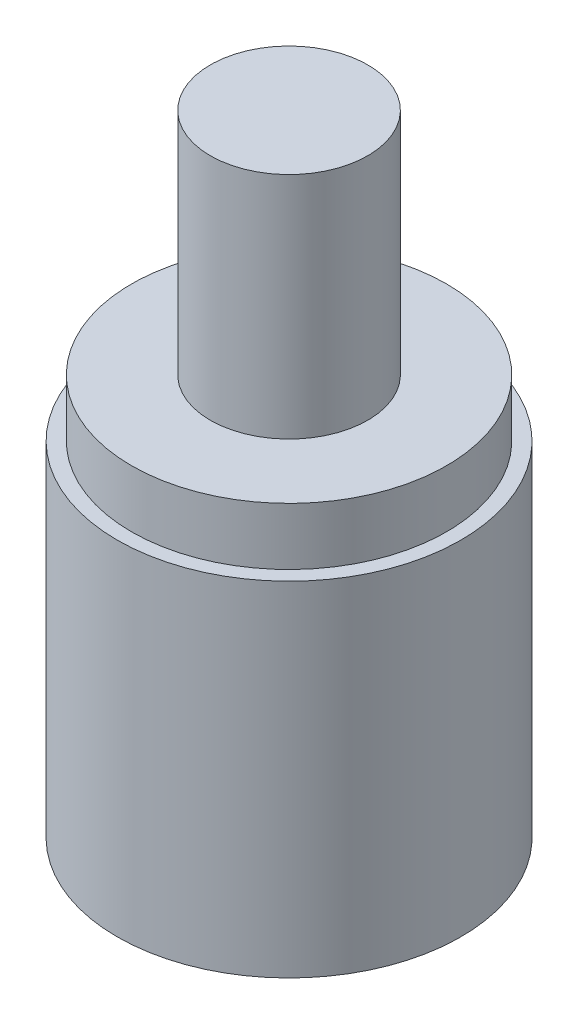
from build123d import *

# Parameters (mm, degrees)
SKETCH_1_R      = 6
SKETCH_1_R_2    = 4.75
EXTRUDE_1_DEPTH = 12
SKETCH_2_R      = 5.5
EXTRUDE_2_DEPTH = 2
SKETCH_3_R      = 2.75
EXTRUDE_3_DEPTH = 8


with BuildPart() as part:
    # 草图1 → 凸台-拉伸1 (new body)
    with BuildSketch(Plane(origin=(0, 0, 0), x_dir=(1, 0, 0), z_dir=(0, 1, 0))):
        with Locations(Location((0, 0, 0), (0, 0, 270))):
            Circle(SKETCH_1_R)
        with Locations(Location((0, 0, 0), (0, 0, 270))):
            Circle(SKETCH_1_R_2, mode=Mode.SUBTRACT)
    extrude(amount=EXTRUDE_1_DEPTH)

    # 草图2 → 凸台-拉伸2 (add)
    with BuildSketch(Plane(origin=(0, 12, 0), x_dir=(1, 0, 0), z_dir=(0, 1, 0))):
        with Locations(Location((0, 0, 0), (0, 0, 270))):
            Circle(SKETCH_2_R)
    extrude(amount=EXTRUDE_2_DEPTH)

    # 草图3 → 凸台-拉伸3 (add)
    with BuildSketch(Plane(origin=(0, 14, 0), x_dir=(1, 0, 0), z_dir=(0, 1, 0))):
        with Locations(Location((0, 0, 0), (0, 0, 270))):
            Circle(SKETCH_3_R)
    extrude(amount=EXTRUDE_3_DEPTH)


solid = part.part
